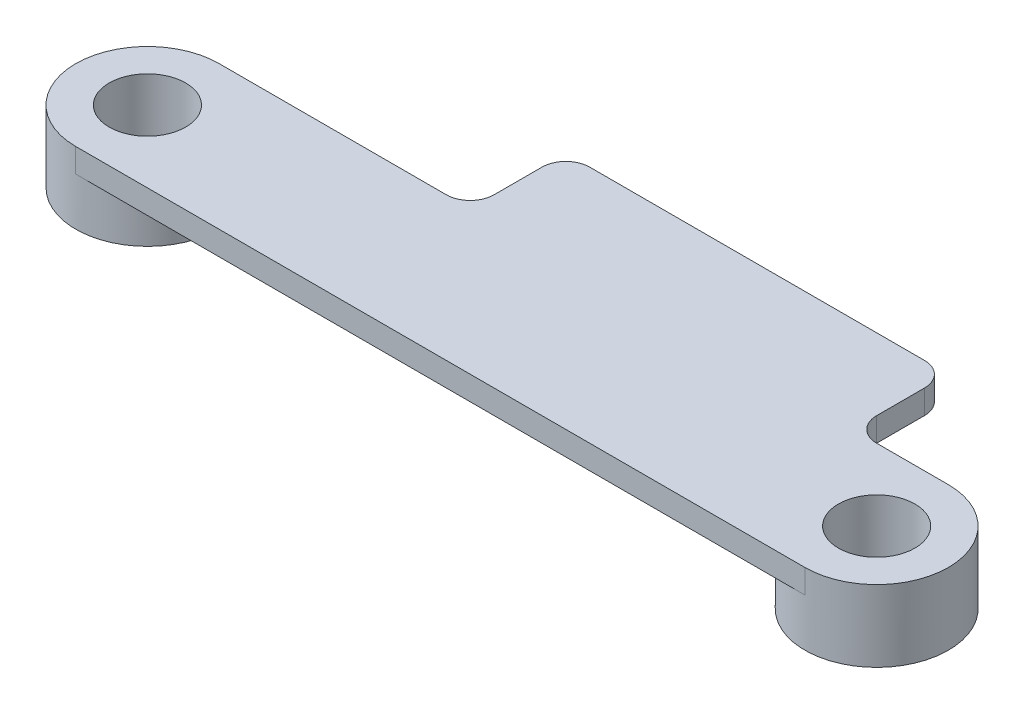
from build123d import *
from build123d.topology import SkipClean

# Parameters (mm, degrees)
SKETCH1_W           = 16
SKETCH1_H           = 6
SKETCH1_H_2         = 4
SKETCH1_R           = 1.6
BOSS_EXTRUDE1_DEPTH = 1
FILLET1_R           = 1
BOSS_EXTRUDE2_START = 2
SKETCH2_R           = 3
SKETCH2_R_2         = 1.6
BOSS_EXTRUDE2_DEPTH = 2


with BuildPart() as part:
    # Sketch1 → Boss-Extrude1 (new body)
    # profile 1 of 4: a face of its own
    with BuildSketch(Plane(origin=(0, 0, 0), x_dir=(1, 0, 0), z_dir=(0, 1, 0))):
        with Locations((3.25, 0)):
            Rectangle(SKETCH1_W, SKETCH1_H)
    # profile 2 of 4: a face of its own
    with BuildSketch(Plane(origin=(0, 0, 0), x_dir=(1, 0, 0), z_dir=(0, 1, 0))):
        with Locations((3.25, 5)):
            Rectangle(SKETCH1_W, SKETCH1_H_2)
    # profile 3 of 4: a face of its own
    with BuildSketch(Plane(origin=(0, 0, 0), x_dir=(1, 0, 0), z_dir=(0, 1, 0))):
        with BuildLine():
            Line((-4.75, 3), (-15.25, 3))
            ThreePointArc((-15.25, 3), (-18.25, 0), (-15.25, -3))
            Line((-15.25, -3), (-4.75, -3))
            Line((-4.75, -3), (-4.75, 3))
        make_face()
        with Locations(Location((-15.25, 0, 0), (0, 0, 270))):
            Circle(SKETCH1_R, mode=Mode.SUBTRACT)
    # profile 4 of 4: a face of its own
    with BuildSketch(Plane(origin=(0, 0, 0), x_dir=(1, 0, 0), z_dir=(0, 1, 0))):
        with BuildLine():
            Line((15.25, 3), (11.25, 3))
            Line((11.25, 3), (11.25, -3))
            Line((11.25, -3), (15.25, -3))
            ThreePointArc((15.25, -3), (18.25, 0), (15.25, 3))
        make_face()
        with Locations(Location((15.25, 0, 0), (0, 0, 270))):
            Circle(SKETCH1_R, mode=Mode.SUBTRACT)
    extrude(amount=BOSS_EXTRUDE1_DEPTH)

    # Fillet1
    fillet1_edges = [part.edges().sort_by_distance(p)[0] for p in [
        (-4.75, 0.5, -3),
        (-4.75, 0.5, -7),
        (11.25, 0.5, -7),
        (11.25, 0.5, -3),
    ]]
    fillet(fillet1_edges, radius=FILLET1_R)

    # Sketch2 → Boss-Extrude2 (add)
    # profile 1 of 2: a face of its own
    with SkipClean():  # the faces are left unmerged after this step: merging them gives an invalid solid
        with BuildSketch(Plane.XZ.offset(BOSS_EXTRUDE2_START)):
            with Locations(Location((-15.25, 0, 0), (0, 0, 270))):
                Circle(SKETCH2_R)
            with Locations(Location((-15.25, 0, 0), (0, 0, 270))):
                Circle(SKETCH2_R_2, mode=Mode.SUBTRACT)
        # profile 2 of 2: a face of its own
        with BuildSketch(Plane.XZ.offset(BOSS_EXTRUDE2_START)):
            with Locations(Location((15.25, 0, 0), (0, 0, 270))):
                Circle(SKETCH2_R)
            with Locations(Location((15.25, 0, 0), (0, 0, 270))):
                Circle(SKETCH2_R_2, mode=Mode.SUBTRACT)
        extrude(amount=-BOSS_EXTRUDE2_DEPTH)


solid = part.part
